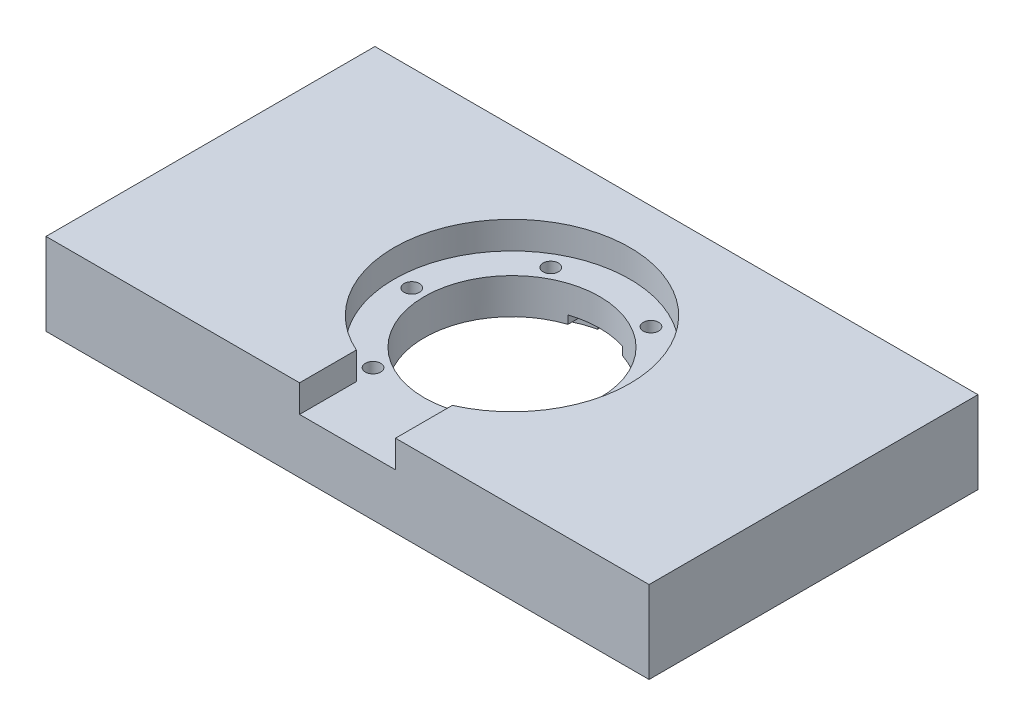
from build123d import *

# Parameters (mm, degrees)
SKETCH1_W               = 220
SKETCH1_H               = 120
SKETCH1_R               = 43
BOSS_EXTRUDE1_DEPTH     = 10
SKETCH2_W               = 220
SKETCH2_H               = 120
SKETCH2_R               = 2.8
BOSS_EXTRUDE2_DEPTH     = 20
CUT_EXTRUDE1_REACH      = 166.012
CUT_EXTRUDE1_END_RADIUS = 43
SKETCH3_W               = 35
SKETCH3_H               = 10
SKETCH4_R               = 32
CUT_EXTRUDE2_DEPTH      = 127.885775404
CUT_EXTRUDE3_REACH      = 166.012
CUT_EXTRUDE3_END_RADIUS = 32
SKETCH5_W               = 20
SKETCH5_H               = 10
SKETCH6_R               = 42.5
CUT_EXTRUDE4_DEPTH      = 7


with BuildPart() as part:
    # Sketch1 → Boss-Extrude1 (new body)
    with BuildSketch(Plane(origin=(0, 0, 0), x_dir=(1, 0, 0), z_dir=(0, 1, 0))):
        Rectangle(SKETCH1_W, SKETCH1_H)
        with Locations(Location((0, 0, 0), (0, 0, 270))):
            Circle(SKETCH1_R, mode=Mode.SUBTRACT)
    extrude(amount=BOSS_EXTRUDE1_DEPTH)

    # Sketch2 → Boss-Extrude2 (add)
    with BuildSketch(Plane.XZ):
        Rectangle(SKETCH2_W, SKETCH2_H)
        with Locations(Location((18.122136771, 32.25814872, 0), (0, 0, 270))):
            Circle(SKETCH2_R, mode=Mode.SUBTRACT)
        with Locations(Location((36.997444656, 0.434843546, 0), (0, 0, 270))):
            Circle(SKETCH2_R, mode=Mode.SUBTRACT)
        with Locations(Location((18.875307886, -31.823305174, 0), (0, 0, 270))):
            Circle(SKETCH2_R, mode=Mode.SUBTRACT)
        with Locations(Location((-18.122136771, -32.25814872, 0), (0, 0, 270))):
            Circle(SKETCH2_R, mode=Mode.SUBTRACT)
        with Locations(Location((-36.997444656, -0.434843546, 0), (0, 0, 270))):
            Circle(SKETCH2_R, mode=Mode.SUBTRACT)
        with Locations(Location((-18.875307886, 31.823305174, 0), (0, 0, 270))):
            Circle(SKETCH2_R, mode=Mode.SUBTRACT)
    extrude(amount=BOSS_EXTRUDE2_DEPTH)

    # Cut-Extrude1: up to this cylinder (the profile starts outside it)
    cut_extrude1_end = Plane(origin=(0, 5, 0), z_dir=(0, -1, 0)) * Cylinder(CUT_EXTRUDE1_END_RADIUS, 419.024, mode=Mode.PRIVATE)
    # Sketch3 → Cut-Extrude1 (cut, up to the surface)
    with BuildSketch(Plane.XY.offset(60), mode=Mode.PRIVATE) as cut_extrude1_sk1:
        with Locations((0, 5)):
            Rectangle(SKETCH3_W, SKETCH3_H)
    cut_extrude1_tool1 = extrude(cut_extrude1_sk1.sketch, amount=-CUT_EXTRUDE1_REACH, mode=Mode.PRIVATE) - cut_extrude1_end
    add(cut_extrude1_tool1.solids().sort_by_distance((0, 5, 60))[0], mode=Mode.SUBTRACT)

    # Sketch4 → Cut-Extrude2 (cut, through all)
    with BuildSketch(Plane(origin=(0, 0, 0), x_dir=(1, 0, 0), z_dir=(0, 1, 0))):
        with Locations(Location((0, 0, 0), (0, 0, 270))):
            Circle(SKETCH4_R)
    extrude(amount=-CUT_EXTRUDE2_DEPTH, mode=Mode.SUBTRACT)

    # Cut-Extrude3: up to this cylinder (the profile starts outside it)
    cut_extrude3_end = Plane(origin=(0, -15, 0), z_dir=(0, 1, 0)) * Cylinder(CUT_EXTRUDE3_END_RADIUS, 397.024, mode=Mode.PRIVATE)
    # Sketch5 → Cut-Extrude3 (cut, up to the surface)
    with BuildSketch(Plane(origin=(0, 0, -60), x_dir=(-1, 0, 0), z_dir=(0, 0, -1)), mode=Mode.PRIVATE) as cut_extrude3_sk1:
        with Locations((0, -15)):
            Rectangle(SKETCH5_W, SKETCH5_H)
    cut_extrude3_tool1 = extrude(cut_extrude3_sk1.sketch, amount=-CUT_EXTRUDE3_REACH, mode=Mode.PRIVATE) - cut_extrude3_end
    add(cut_extrude3_tool1.solids().sort_by_distance((0, -15, -60))[0], mode=Mode.SUBTRACT)

    # Sketch6 → Cut-Extrude4 (cut)
    with BuildSketch(Plane.XZ.offset(20)):
        Circle(SKETCH6_R)
    extrude(amount=-CUT_EXTRUDE4_DEPTH, mode=Mode.SUBTRACT)


solid = part.part
